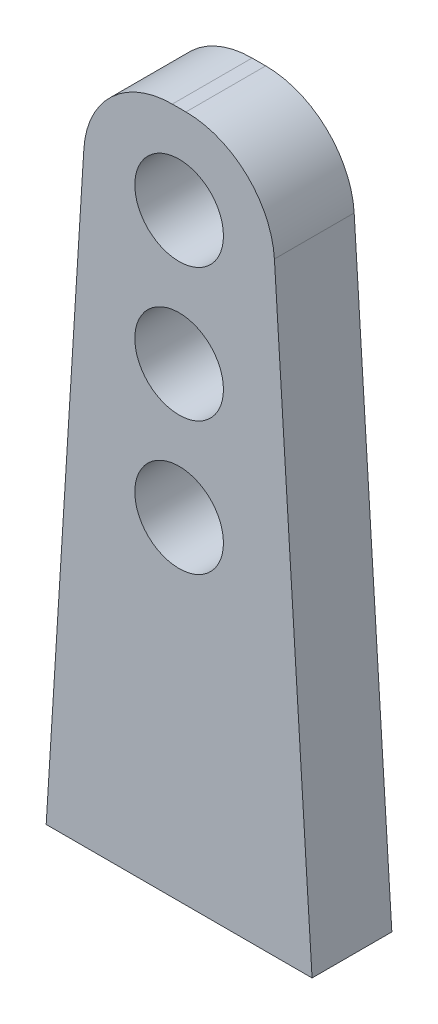
from build123d import *

# Parameters (mm, degrees)
SKETCH1_R           = 0.5
BOSS_EXTRUDE1_DEPTH = 0.899922


with BuildPart() as part:
    # Sketch1 → Boss-Extrude1 (new body)
    with BuildSketch(Plane.XY):
        with BuildLine():
            Line((1.569871125, 7.70179743), (1.41624751, 7.70179743))
            ThreePointArc((1.41624751, 7.70179743), (0.731524296, 7.430600641), (0.418190556, 6.764105671))
            Line((0.418190556, 6.764105671), (-0.007098742, -0.04820257))
            Line((-0.007098742, -0.04820257), (2.992901258, -0.04820257))
            Line((2.992901258, -0.04820257), (2.567930958, 6.764059536))
            ThreePointArc((2.567930958, 6.764059536), (2.254611183, 7.430584816), (1.569871125, 7.70179743))
        make_face()
        with Locations((1.492901258, 3.70179743)):
            Circle(SKETCH1_R, mode=Mode.SUBTRACT)
        with Locations((1.492901258, 5.20179743)):
            Circle(SKETCH1_R, mode=Mode.SUBTRACT)
        with Locations((1.492901258, 6.70179743)):
            Circle(SKETCH1_R, mode=Mode.SUBTRACT)
    extrude(amount=BOSS_EXTRUDE1_DEPTH)


solid = part.part
